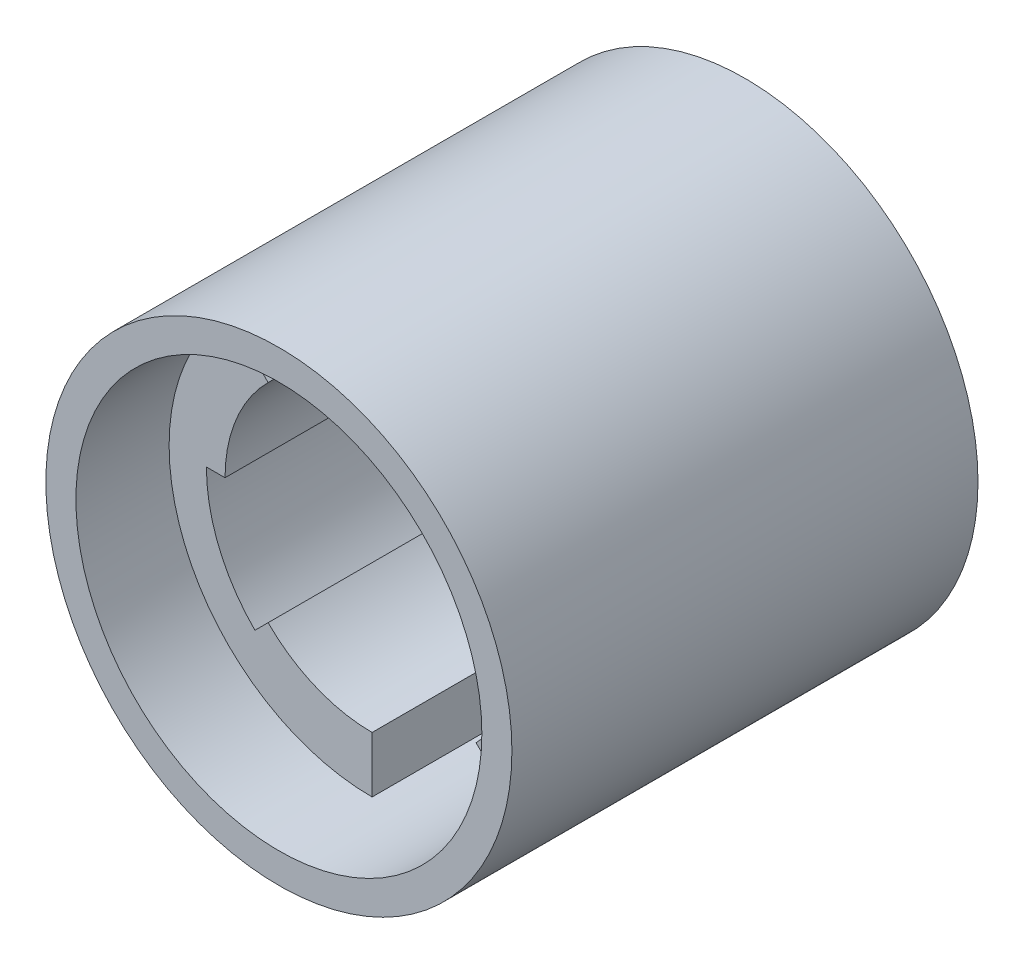
from build123d import *

# Parameters (mm, degrees)
SKETCH1_R           = 25
SKETCH1_R_2         = 21.775
BOSS_EXTRUDE1_DEPTH = 50
BOSS_EXTRUDE2_START = -20
BOSS_EXTRUDE2_DEPTH = 20
BOSS_EXTRUDE3_REACH = 60.561
BOSS_EXTRUDE4_REACH = 62.226


with BuildPart() as part:
    # Sketch1 → Boss-Extrude1 (new body)
    with BuildSketch(Plane.XY):
        Circle(SKETCH1_R)
        Circle(SKETCH1_R_2, mode=Mode.SUBTRACT)
    extrude(amount=BOSS_EXTRUDE1_DEPTH)

    # Sketch2 → Boss-Extrude2 (add)
    with BuildSketch(Plane(origin=(0, 0, 0), x_dir=(-1, 0, 0), z_dir=(0, 0, -1)).offset(BOSS_EXTRUDE2_START)):
        with BuildLine():
            Line((-15.39725016, -15.39725016), (-11.154609473, -11.154609473))
            ThreePointArc((-11.154609473, -11.154609473), (-14.574199625, -6.036831146), (-15.775, 0))
            Line((-15.775, 0), (-17.775, 0))
            ThreePointArc((-17.775, 0), (-16.42195869, 6.80219801), (-12.568823036, 12.568823036))
            Line((-12.568823036, 12.568823036), (-11.154609473, 11.154609473))
            ThreePointArc((-11.154609473, 11.154609473), (-6.036831146, 14.574199625), (0, 15.775))
            Line((0, 15.775), (0, 21.775))
            ThreePointArc((0, 21.775), (-20.11747682, 8.33293174), (-15.39725016, -15.39725016))
        make_face()
        with BuildLine():
            Line((0, -15.77607933), (0, -21.775))
            ThreePointArc((0, -21.775), (20.11747682, -8.33293174), (15.39725016, 15.39725016))
            Line((15.39725016, 15.39725016), (11.155372675, 11.155372675))
            ThreePointArc((11.155372675, 11.155372675), (14.575196796, 6.037244187), (15.77607933, 0))
            Line((15.77607933, 0), (17.77607933, 0))
            ThreePointArc((17.77607933, 0), (16.422955861, -6.802611052), (12.569586237, -12.569586237))
            Line((12.569586237, -12.569586237), (11.155372675, -11.155372675))
            ThreePointArc((11.155372675, -11.155372675), (6.037244187, -14.575196796), (0, -15.77607933))
        make_face()
    extrude(amount=-BOSS_EXTRUDE2_DEPTH)

    # Sketch3 → Boss-Extrude3 (add, up to next)
    with BuildSketch(Plane(origin=(6.036831146, 14.574199625, 20), x_dir=(-0.9238795325112862, 0.38268343236509134, 0), z_dir=(-0.38268343236509134, -0.9238795325112862, 0)), mode=Mode.PRIVATE) as boss_extrude3_sk1:
        Polygon((7.280816653, -19.963261278), (-6.92881971, -19.963261278), (-6.92881971, -24.309436753), (7.280816653, -22.136349016), align=None)
    boss_extrude3_tool1 = extrude(boss_extrude3_sk1.sketch, amount=-BOSS_EXTRUDE3_REACH, mode=Mode.PRIVATE) - part.part
    add(boss_extrude3_tool1.solids().sort_by_distance((6.603563, 14.339452, 41.653441))[0])

    # Sketch4 → Boss-Extrude4 (add, up to next)
    with BuildSketch(Plane(origin=(16.42195869, 6.80219801, 20), x_dir=(0, 0, 1), z_dir=(-0.9238795325112876, -0.38268343236508784, 0)), mode=Mode.PRIVATE) as boss_extrude4_sk1:
        Polygon((24.315182013, 6.595374184), (25.634239275, -5.93507645), (20.034984376, -5.93507645), (20.034984376, 7.085544356), (24.315182013, 7.085544356), align=None)
    boss_extrude4_tool1 = extrude(boss_extrude4_sk1.sketch, amount=-BOSS_EXTRUDE4_REACH, mode=Mode.PRIVATE) - part.part
    add(boss_extrude4_tool1.solids().sort_by_distance((16.317145, 7.05524, 42.508231))[0])


solid = part.part
